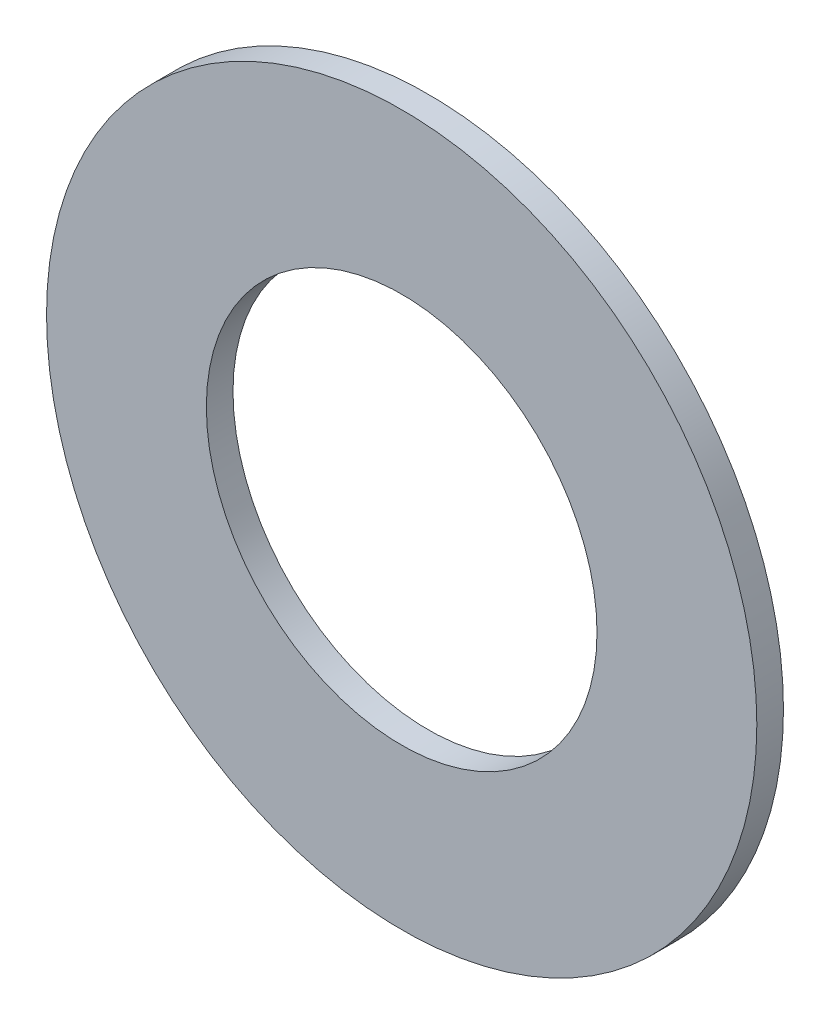
from build123d import *

# Parameters (mm, degrees)
SKETCH1_R           = 10
SKETCH1_R_2         = 5.5
BOSS_EXTRUDE1_DEPTH = 0.75


with BuildPart() as part:
    # Sketch1 → Boss-Extrude1 (new body)
    with BuildSketch(Plane.XY):
        Circle(SKETCH1_R)
        Circle(SKETCH1_R_2, mode=Mode.SUBTRACT)
    extrude(amount=BOSS_EXTRUDE1_DEPTH)


solid = part.part
